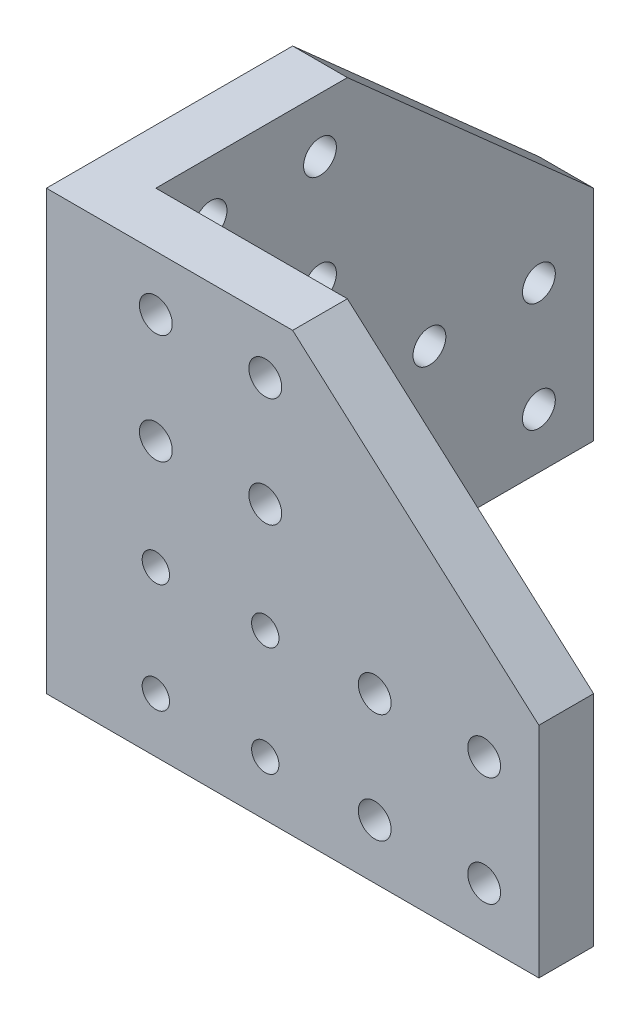
from build123d import *

# Parameters (mm, degrees)
BOSS_EXTRUDE1_DEPTH = 80
CUT_EXTRUDE1_REACH  = 152.333
CUT_EXTRUDE2_REACH  = 152.333
CUT_EXTRUDE3_REACH  = 152.333
SKETCH4_R           = 2.5
SKETCH4_R_2         = 3
CUT_EXTRUDE4_REACH  = 152.333
SKETCH5_R           = 3


with BuildPart() as part:
    # Sketch1 → Boss-Extrude1 (new body)
    with BuildSketch(Plane(origin=(0, 0, 0), x_dir=(1, 0, 0), z_dir=(0, 1, 0))):
        Polygon((0, 0), (90, 0), (90, 10), (10, 10), (10, 90), (0, 90), align=None)
    extrude(amount=BOSS_EXTRUDE1_DEPTH)

    # Sketch2 → Cut-Extrude1 (cut, up to next)
    with BuildSketch(Plane.XY, mode=Mode.PRIVATE) as cut_extrude1_sk1:
        Polygon((90, 80), (90, 40), (45, 80), align=None)
    cut_extrude1_tool1 = extrude(cut_extrude1_sk1.sketch, amount=-CUT_EXTRUDE1_REACH, mode=Mode.PRIVATE) & part.part
    add(cut_extrude1_tool1.solids().sort_by_distance((75, 66.666667, 0))[0], mode=Mode.SUBTRACT)

    # Sketch3 → Cut-Extrude2 (cut, up to next)
    with BuildSketch(Plane.ZY, mode=Mode.PRIVATE) as cut_extrude2_sk1:
        Polygon((-45, 80), (-90, 40), (-90, 80), align=None)
    cut_extrude2_tool1 = extrude(cut_extrude2_sk1.sketch, amount=-CUT_EXTRUDE2_REACH, mode=Mode.PRIVATE) & part.part
    add(cut_extrude2_tool1.solids().sort_by_distance((0, 66.666667, -75))[0], mode=Mode.SUBTRACT)

    # Sketch4 → Cut-Extrude3 (cut, up to next)
    with BuildSketch(Plane.XY, mode=Mode.PRIVATE) as cut_extrude3_sk1:
        with Locations((20, 30)):
            Circle(SKETCH4_R)
    cut_extrude3_tool1 = extrude(cut_extrude3_sk1.sketch, amount=-CUT_EXTRUDE3_REACH, mode=Mode.PRIVATE) & part.part
    # Sketch4 → Cut-Extrude3 (cut, up to next)
    with BuildSketch(Plane.XY, mode=Mode.PRIVATE) as cut_extrude3_sk2:
        with Locations((40, 30)):
            Circle(SKETCH4_R)
    cut_extrude3_tool2 = extrude(cut_extrude3_sk2.sketch, amount=-CUT_EXTRUDE3_REACH, mode=Mode.PRIVATE) & part.part
    # Sketch4 → Cut-Extrude3 (cut, up to next)
    with BuildSketch(Plane.XY, mode=Mode.PRIVATE) as cut_extrude3_sk3:
        with Locations((20, 10)):
            Circle(SKETCH4_R)
    cut_extrude3_tool3 = extrude(cut_extrude3_sk3.sketch, amount=-CUT_EXTRUDE3_REACH, mode=Mode.PRIVATE) & part.part
    # Sketch4 → Cut-Extrude3 (cut, up to next)
    with BuildSketch(Plane.XY, mode=Mode.PRIVATE) as cut_extrude3_sk4:
        with Locations((40, 10)):
            Circle(SKETCH4_R)
    cut_extrude3_tool4 = extrude(cut_extrude3_sk4.sketch, amount=-CUT_EXTRUDE3_REACH, mode=Mode.PRIVATE) & part.part
    # Sketch4 → Cut-Extrude3 (cut, up to next)
    with BuildSketch(Plane.XY, mode=Mode.PRIVATE) as cut_extrude3_sk5:
        with Locations((60, 10)):
            Circle(SKETCH4_R_2)
    cut_extrude3_tool5 = extrude(cut_extrude3_sk5.sketch, amount=-CUT_EXTRUDE3_REACH, mode=Mode.PRIVATE) & part.part
    # Sketch4 → Cut-Extrude3 (cut, up to next)
    with BuildSketch(Plane.XY, mode=Mode.PRIVATE) as cut_extrude3_sk6:
        with Locations((80, 10)):
            Circle(SKETCH4_R_2)
    cut_extrude3_tool6 = extrude(cut_extrude3_sk6.sketch, amount=-CUT_EXTRUDE3_REACH, mode=Mode.PRIVATE) & part.part
    # Sketch4 → Cut-Extrude3 (cut, up to next)
    with BuildSketch(Plane.XY, mode=Mode.PRIVATE) as cut_extrude3_sk7:
        with Locations((60, 30)):
            Circle(SKETCH4_R_2)
    cut_extrude3_tool7 = extrude(cut_extrude3_sk7.sketch, amount=-CUT_EXTRUDE3_REACH, mode=Mode.PRIVATE) & part.part
    # Sketch4 → Cut-Extrude3 (cut, up to next)
    with BuildSketch(Plane.XY, mode=Mode.PRIVATE) as cut_extrude3_sk8:
        with Locations((80, 30)):
            Circle(SKETCH4_R_2)
    cut_extrude3_tool8 = extrude(cut_extrude3_sk8.sketch, amount=-CUT_EXTRUDE3_REACH, mode=Mode.PRIVATE) & part.part
    # Sketch4 → Cut-Extrude3 (cut, up to next)
    with BuildSketch(Plane.XY, mode=Mode.PRIVATE) as cut_extrude3_sk9:
        with Locations((40, 50)):
            Circle(SKETCH4_R_2)
    cut_extrude3_tool9 = extrude(cut_extrude3_sk9.sketch, amount=-CUT_EXTRUDE3_REACH, mode=Mode.PRIVATE) & part.part
    # Sketch4 → Cut-Extrude3 (cut, up to next)
    with BuildSketch(Plane.XY, mode=Mode.PRIVATE) as cut_extrude3_sk10:
        with Locations((20, 50)):
            Circle(SKETCH4_R_2)
    cut_extrude3_tool10 = extrude(cut_extrude3_sk10.sketch, amount=-CUT_EXTRUDE3_REACH, mode=Mode.PRIVATE) & part.part
    # Sketch4 → Cut-Extrude3 (cut, up to next)
    with BuildSketch(Plane.XY, mode=Mode.PRIVATE) as cut_extrude3_sk11:
        with Locations((20, 70)):
            Circle(SKETCH4_R_2)
    cut_extrude3_tool11 = extrude(cut_extrude3_sk11.sketch, amount=-CUT_EXTRUDE3_REACH, mode=Mode.PRIVATE) & part.part
    # Sketch4 → Cut-Extrude3 (cut, up to next)
    with BuildSketch(Plane.XY, mode=Mode.PRIVATE) as cut_extrude3_sk12:
        with Locations((40, 70)):
            Circle(SKETCH4_R_2)
    cut_extrude3_tool12 = extrude(cut_extrude3_sk12.sketch, amount=-CUT_EXTRUDE3_REACH, mode=Mode.PRIVATE) & part.part
    add(cut_extrude3_tool1.solids().sort_by_distance((20, 30, 0))[0], mode=Mode.SUBTRACT)
    add(cut_extrude3_tool2.solids().sort_by_distance((40, 30, 0))[0], mode=Mode.SUBTRACT)
    add(cut_extrude3_tool3.solids().sort_by_distance((20, 10, 0))[0], mode=Mode.SUBTRACT)
    add(cut_extrude3_tool4.solids().sort_by_distance((40, 10, 0))[0], mode=Mode.SUBTRACT)
    add(cut_extrude3_tool5.solids().sort_by_distance((60, 10, 0))[0], mode=Mode.SUBTRACT)
    add(cut_extrude3_tool6.solids().sort_by_distance((80, 10, 0))[0], mode=Mode.SUBTRACT)
    add(cut_extrude3_tool7.solids().sort_by_distance((60, 30, 0))[0], mode=Mode.SUBTRACT)
    add(cut_extrude3_tool8.solids().sort_by_distance((80, 30, 0))[0], mode=Mode.SUBTRACT)
    add(cut_extrude3_tool9.solids().sort_by_distance((40, 50, 0))[0], mode=Mode.SUBTRACT)
    add(cut_extrude3_tool10.solids().sort_by_distance((20, 50, 0))[0], mode=Mode.SUBTRACT)
    add(cut_extrude3_tool11.solids().sort_by_distance((20, 70, 0))[0], mode=Mode.SUBTRACT)
    add(cut_extrude3_tool12.solids().sort_by_distance((40, 70, 0))[0], mode=Mode.SUBTRACT)

    # Sketch5 → Cut-Extrude4 (cut, up to next)
    with BuildSketch(Plane.ZY, mode=Mode.PRIVATE) as cut_extrude4_sk1:
        with Locations((-20, 70)):
            Circle(SKETCH5_R)
    cut_extrude4_tool1 = extrude(cut_extrude4_sk1.sketch, amount=-CUT_EXTRUDE4_REACH, mode=Mode.PRIVATE) & part.part
    # Sketch5 → Cut-Extrude4 (cut, up to next)
    with BuildSketch(Plane.ZY, mode=Mode.PRIVATE) as cut_extrude4_sk2:
        with Locations((-40, 70)):
            Circle(SKETCH5_R)
    cut_extrude4_tool2 = extrude(cut_extrude4_sk2.sketch, amount=-CUT_EXTRUDE4_REACH, mode=Mode.PRIVATE) & part.part
    # Sketch5 → Cut-Extrude4 (cut, up to next)
    with BuildSketch(Plane.ZY, mode=Mode.PRIVATE) as cut_extrude4_sk3:
        with Locations((-20, 50)):
            Circle(SKETCH5_R)
    cut_extrude4_tool3 = extrude(cut_extrude4_sk3.sketch, amount=-CUT_EXTRUDE4_REACH, mode=Mode.PRIVATE) & part.part
    # Sketch5 → Cut-Extrude4 (cut, up to next)
    with BuildSketch(Plane.ZY, mode=Mode.PRIVATE) as cut_extrude4_sk4:
        with Locations((-40, 50)):
            Circle(SKETCH5_R)
    cut_extrude4_tool4 = extrude(cut_extrude4_sk4.sketch, amount=-CUT_EXTRUDE4_REACH, mode=Mode.PRIVATE) & part.part
    # Sketch5 → Cut-Extrude4 (cut, up to next)
    with BuildSketch(Plane.ZY, mode=Mode.PRIVATE) as cut_extrude4_sk5:
        with Locations((-20, 30)):
            Circle(SKETCH5_R)
    cut_extrude4_tool5 = extrude(cut_extrude4_sk5.sketch, amount=-CUT_EXTRUDE4_REACH, mode=Mode.PRIVATE) & part.part
    # Sketch5 → Cut-Extrude4 (cut, up to next)
    with BuildSketch(Plane.ZY, mode=Mode.PRIVATE) as cut_extrude4_sk6:
        with Locations((-40, 30)):
            Circle(SKETCH5_R)
    cut_extrude4_tool6 = extrude(cut_extrude4_sk6.sketch, amount=-CUT_EXTRUDE4_REACH, mode=Mode.PRIVATE) & part.part
    # Sketch5 → Cut-Extrude4 (cut, up to next)
    with BuildSketch(Plane.ZY, mode=Mode.PRIVATE) as cut_extrude4_sk7:
        with Locations((-20, 10)):
            Circle(SKETCH5_R)
    cut_extrude4_tool7 = extrude(cut_extrude4_sk7.sketch, amount=-CUT_EXTRUDE4_REACH, mode=Mode.PRIVATE) & part.part
    # Sketch5 → Cut-Extrude4 (cut, up to next)
    with BuildSketch(Plane.ZY, mode=Mode.PRIVATE) as cut_extrude4_sk8:
        with Locations((-40, 10)):
            Circle(SKETCH5_R)
    cut_extrude4_tool8 = extrude(cut_extrude4_sk8.sketch, amount=-CUT_EXTRUDE4_REACH, mode=Mode.PRIVATE) & part.part
    # Sketch5 → Cut-Extrude4 (cut, up to next)
    with BuildSketch(Plane.ZY, mode=Mode.PRIVATE) as cut_extrude4_sk9:
        with Locations((-60, 10)):
            Circle(SKETCH5_R)
    cut_extrude4_tool9 = extrude(cut_extrude4_sk9.sketch, amount=-CUT_EXTRUDE4_REACH, mode=Mode.PRIVATE) & part.part
    # Sketch5 → Cut-Extrude4 (cut, up to next)
    with BuildSketch(Plane.ZY, mode=Mode.PRIVATE) as cut_extrude4_sk10:
        with Locations((-60, 30)):
            Circle(SKETCH5_R)
    cut_extrude4_tool10 = extrude(cut_extrude4_sk10.sketch, amount=-CUT_EXTRUDE4_REACH, mode=Mode.PRIVATE) & part.part
    # Sketch5 → Cut-Extrude4 (cut, up to next)
    with BuildSketch(Plane.ZY, mode=Mode.PRIVATE) as cut_extrude4_sk11:
        with Locations((-80, 30)):
            Circle(SKETCH5_R)
    cut_extrude4_tool11 = extrude(cut_extrude4_sk11.sketch, amount=-CUT_EXTRUDE4_REACH, mode=Mode.PRIVATE) & part.part
    # Sketch5 → Cut-Extrude4 (cut, up to next)
    with BuildSketch(Plane.ZY, mode=Mode.PRIVATE) as cut_extrude4_sk12:
        with Locations((-80, 10)):
            Circle(SKETCH5_R)
    cut_extrude4_tool12 = extrude(cut_extrude4_sk12.sketch, amount=-CUT_EXTRUDE4_REACH, mode=Mode.PRIVATE) & part.part
    add(cut_extrude4_tool1.solids().sort_by_distance((0, 70, -20))[0], mode=Mode.SUBTRACT)
    add(cut_extrude4_tool2.solids().sort_by_distance((0, 70, -40))[0], mode=Mode.SUBTRACT)
    add(cut_extrude4_tool3.solids().sort_by_distance((0, 50, -20))[0], mode=Mode.SUBTRACT)
    add(cut_extrude4_tool4.solids().sort_by_distance((0, 50, -40))[0], mode=Mode.SUBTRACT)
    add(cut_extrude4_tool5.solids().sort_by_distance((0, 30, -20))[0], mode=Mode.SUBTRACT)
    add(cut_extrude4_tool6.solids().sort_by_distance((0, 30, -40))[0], mode=Mode.SUBTRACT)
    add(cut_extrude4_tool7.solids().sort_by_distance((0, 10, -20))[0], mode=Mode.SUBTRACT)
    add(cut_extrude4_tool8.solids().sort_by_distance((0, 10, -40))[0], mode=Mode.SUBTRACT)
    add(cut_extrude4_tool9.solids().sort_by_distance((0, 10, -60))[0], mode=Mode.SUBTRACT)
    add(cut_extrude4_tool10.solids().sort_by_distance((0, 30, -60))[0], mode=Mode.SUBTRACT)
    add(cut_extrude4_tool11.solids().sort_by_distance((0, 30, -80))[0], mode=Mode.SUBTRACT)
    add(cut_extrude4_tool12.solids().sort_by_distance((0, 10, -80))[0], mode=Mode.SUBTRACT)


solid = part.part
